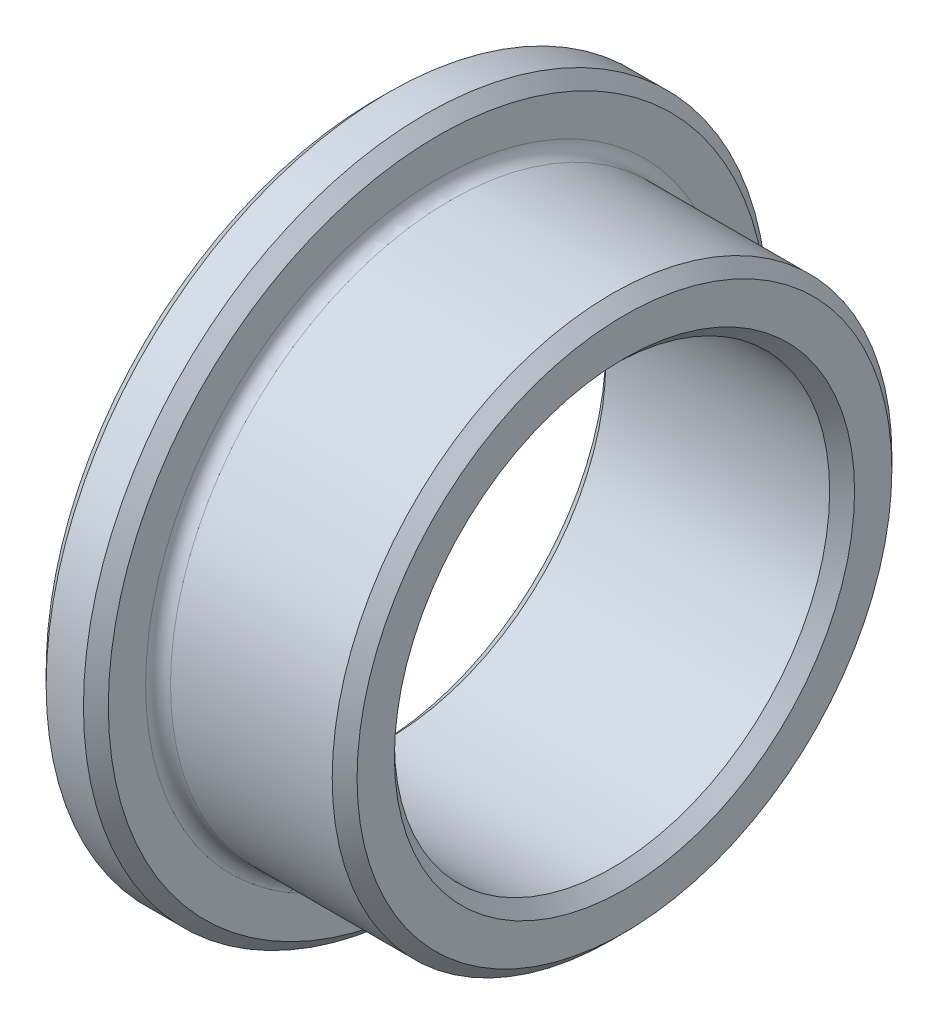
from build123d import *

# Parameters (mm, degrees)
CHAMFER1_SIZE = 1
FILLET1_R     = 1


with BuildPart() as part:
    # Sketch1 → Revolve1 (revolve)
    with BuildSketch(Plane.XY, mode=Mode.PRIVATE) as revolve1_sk:
        Polygon((0, 17.5), (20, 17.5), (20, 22.5), (5, 22.5), (5, 27.5), (0, 27.5), align=None)
    revolve(revolve1_sk.sketch.rotate(Axis((0, 0, 0), (1, 0, 0)), 90), axis=Axis((0, 0, 0), (1, 0, 0)))

    # Chamfer1
    chamfer1_edges = [part.edges().sort_by_distance(p)[0] for p in [
        (0, 0, -27.5),
        (5, 0, -27.5),
        (20, 0, -22.5),
        (20, 0, -17.5),
        (0, 0, -17.5),
    ]]
    chamfer(chamfer1_edges, length=CHAMFER1_SIZE)

    # Fillet1
    fillet1_edges = [part.edges().sort_by_distance(p)[0] for p in [
        (5, 0, -22.5),
    ]]
    fillet(fillet1_edges, radius=FILLET1_R)


solid = part.part
